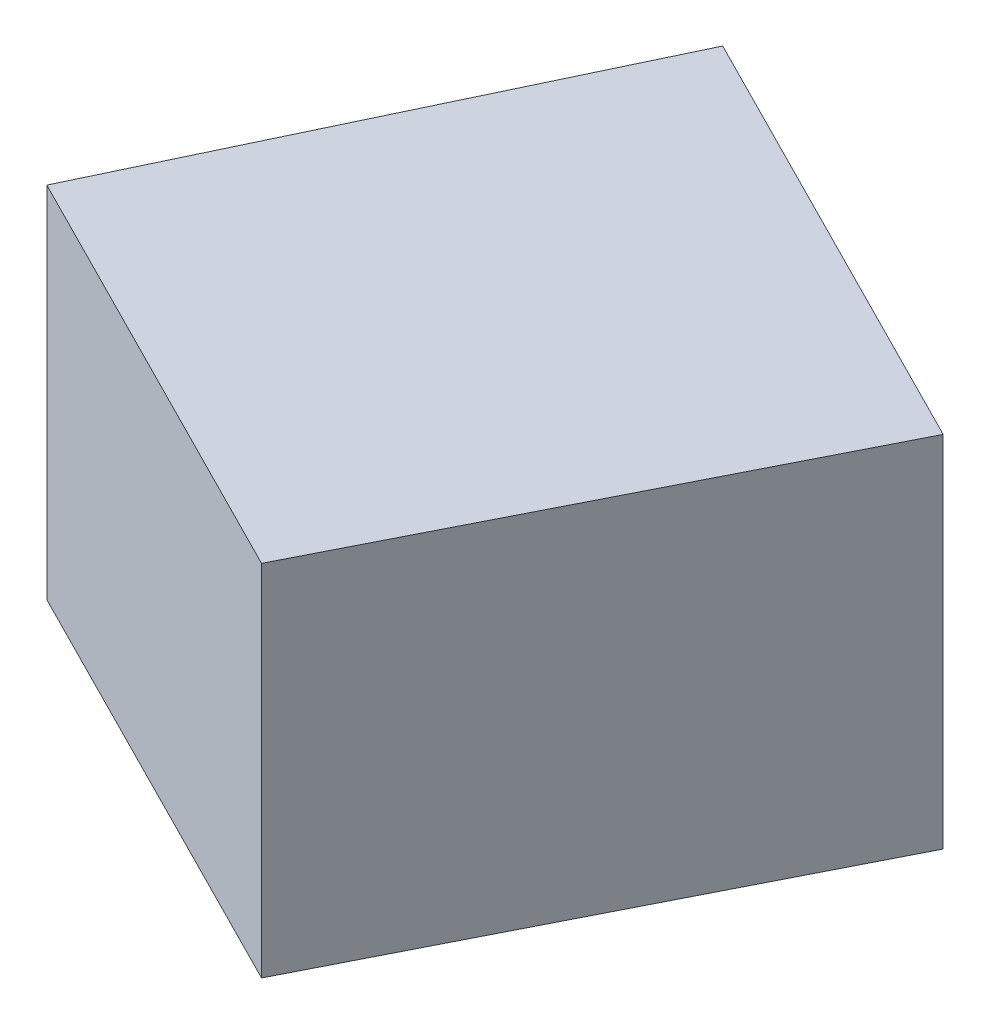
from build123d import *

# Parameters (mm, degrees)
BOSS_EXTRUDE1_DEPTH = 57


with BuildPart() as part:
    # Sketch1 → Boss-Extrude1 (new body)
    with BuildSketch(Plane(origin=(0, 0, 0), x_dir=(1, 0, 0), z_dir=(0, 1, 0))):
        Polygon((-61.056591485, -7.280446556), (7.987085874, -42.239270535), (44.357014022, 29.591337558), (-26.534752805, 65.48590304), align=None)
    extrude(amount=BOSS_EXTRUDE1_DEPTH)


with BuildPart() as part_1:
    # Body-Move/Copy1: moved
    add(part.part.moved(Location((225.907442725, -44.50208272, 261.850974157))))


solid = part_1.part
